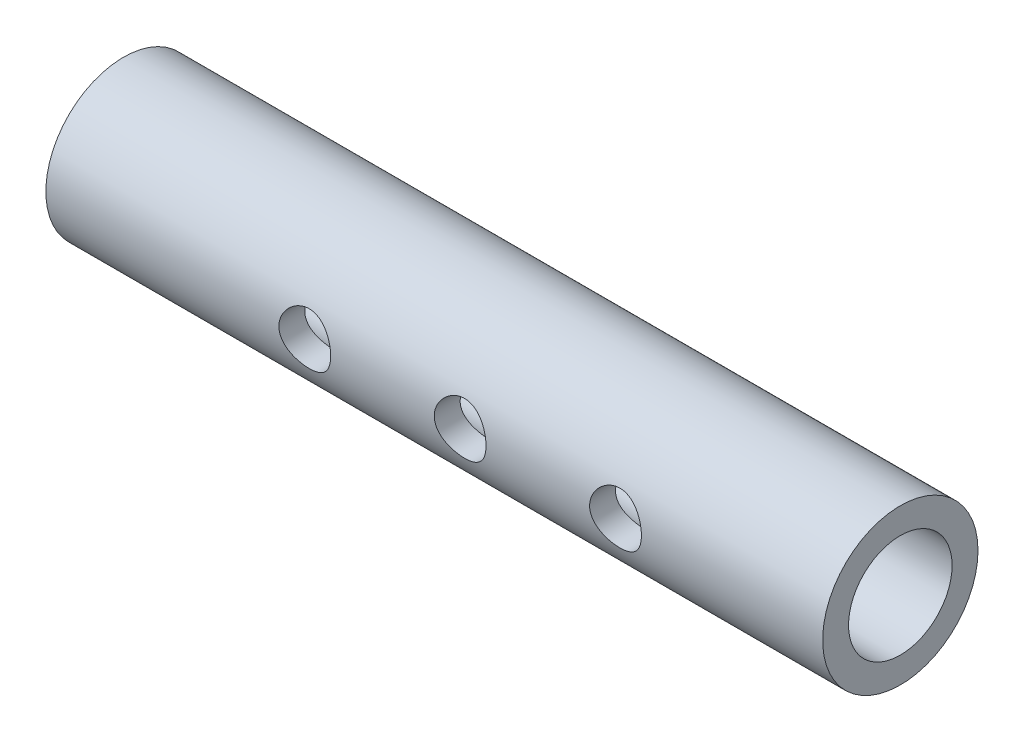
from build123d import *

# Parameters (mm, degrees)
SWEEP_THIN1_PROFILE_R   = 15
SWEEP_THIN1_PROFILE_R_2 = 10
CUT_EXTRUDE1_DEPTH      = 258.544221288
CUT_EXTRUDE1_DEPTH_BACK = 258.544221288
SKETCH5_R               = 5


with BuildPart() as part:
    # Sweep-Thin1: sweep along a path in Sketch2
    with BuildLine(Plane(origin=(0, 0, 0), x_dir=(1, 0, 0), z_dir=(0, 1, 0))) as sweep_thin1_path:
        Line((106.669098098, 180), (256.669098098, 180))
    # Sweep-Thin1 profile (on start of the path) → Sweep-Thin1 (sweep)
    with BuildSketch(Plane(origin=(106.669098098, 0, -180), x_dir=(0, 0, 1), z_dir=(1, 0, 0))):
        Circle(SWEEP_THIN1_PROFILE_R)
        Circle(SWEEP_THIN1_PROFILE_R_2, mode=Mode.SUBTRACT)
    sweep(path=sweep_thin1_path.line)

    # Sketch5 → Cut-Extrude1 (cut, two sides: drawn at the far end of the back side and taken through both)
    with BuildSketch(Plane.XY.offset(-180).offset(-CUT_EXTRUDE1_DEPTH_BACK)):
        with Locations((216.669098098, 0)):
            Circle(SKETCH5_R)
        with Locations((186.669098098, 0)):
            Circle(SKETCH5_R)
        with Locations((156.669098098, 0)):
            Circle(SKETCH5_R)
    extrude(amount=CUT_EXTRUDE1_DEPTH + CUT_EXTRUDE1_DEPTH_BACK, mode=Mode.SUBTRACT)


solid = part.part
